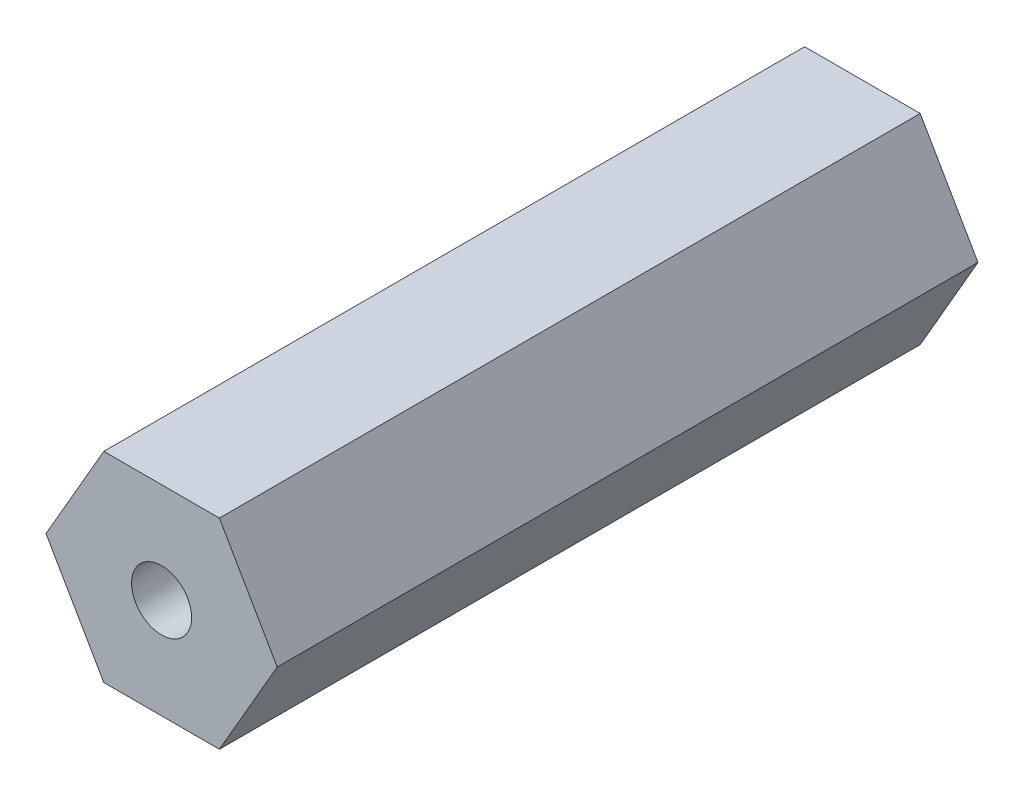
from build123d import *

# Parameters (mm, degrees)
SKETCH1_R           = 1.5
BOSS_EXTRUDE1_DEPTH = 35


with BuildPart() as part:
    # Sketch1 → Boss-Extrude1 (new body)
    with BuildSketch(Plane.XY):
        Polygon((5.773502692, 0), (2.886751346, 5), (-2.886751346, 5), (-5.773502692, 0), (-2.886751346, -5), (2.886751346, -5), align=None)
        Circle(SKETCH1_R, mode=Mode.SUBTRACT)
    extrude(amount=BOSS_EXTRUDE1_DEPTH)


solid = part.part
